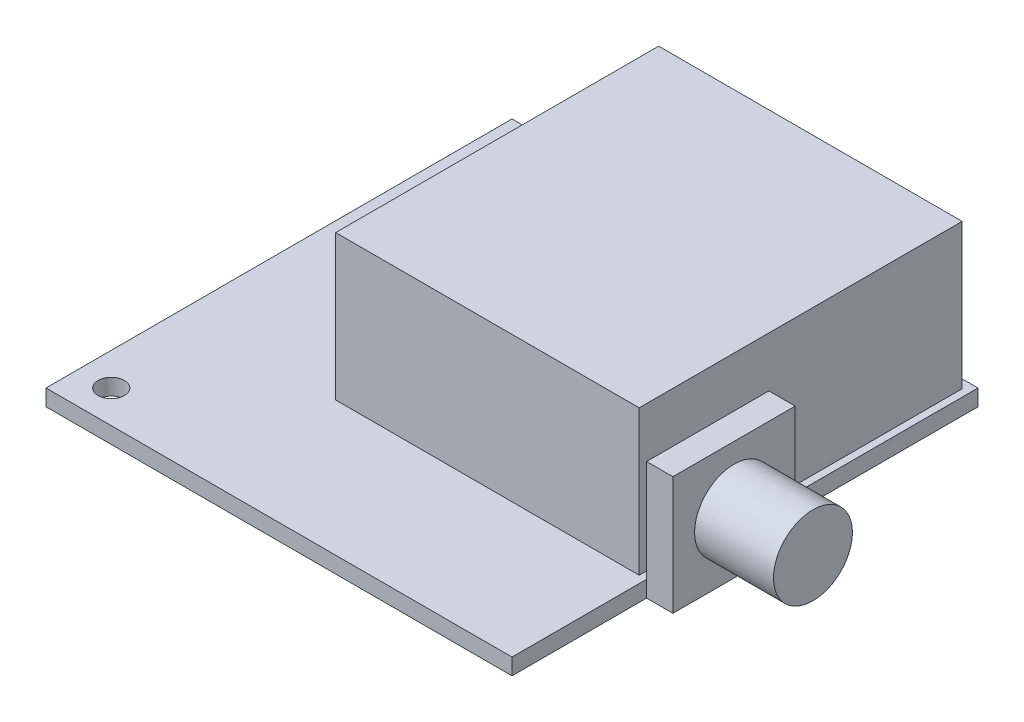
from build123d import *

# Parameters (mm, degrees)
SKETCH1_W           = 45
SKETCH1_H           = 45
SKETCH1_R           = 1.27
BOSS_EXTRUDE1_DEPTH = 1.5748
SKETCH2_W           = 29.307993044
SKETCH2_H           = 31.185373382
BOSS_EXTRUDE2_DEPTH = 14
SKETCH3_W           = 11.809383556
SKETCH3_H           = 11.428065242
BOSS_EXTRUDE3_DEPTH = 2.54
SKETCH4_R           = 3.81
BOSS_EXTRUDE4_DEPTH = 7.62


with BuildPart() as part:
    # Sketch1 → Boss-Extrude1 (new body)
    with BuildSketch(Plane(origin=(0, 0, 0), x_dir=(1, 0, 0), z_dir=(0, 1, 0))):
        Rectangle(SKETCH1_W, SKETCH1_H)
        with Locations(Location((-19.3504, 19.3504, 0), (0, 0, 270))):
            Circle(SKETCH1_R, mode=Mode.SUBTRACT)
        with Locations(Location((-19.3504, -19.3504, 0), (0, 0, 270))):
            Circle(SKETCH1_R, mode=Mode.SUBTRACT)
    extrude(amount=BOSS_EXTRUDE1_DEPTH)

    # Sketch2 → Boss-Extrude2 (add)
    with BuildSketch(Plane(origin=(0, 1.5748, 0), x_dir=(1, 0, 0), z_dir=(0, 1, 0))):
        with Locations((7.144475173, 6.07541137)):
            Rectangle(SKETCH2_W, SKETCH2_H)
    extrude(amount=BOSS_EXTRUDE2_DEPTH)

    # Sketch3 → Boss-Extrude3 (add)
    with BuildSketch(Plane(origin=(22.5, 0, 0), x_dir=(0, 0, -1), z_dir=(1, 0, 0))):
        with Locations((-3.598382338, 5.714032621)):
            Rectangle(SKETCH3_W, SKETCH3_H)
    extrude(amount=BOSS_EXTRUDE3_DEPTH)

    # Sketch4 → Boss-Extrude4 (add)
    with BuildSketch(Plane(origin=(25.04, 0, 0), x_dir=(0, 0, -1), z_dir=(1, 0, 0))):
        with Locations(Location((-3.598382338, 5.714032621, 0), (0, 0, 180))):
            Circle(SKETCH4_R)
    extrude(amount=BOSS_EXTRUDE4_DEPTH)


solid = part.part
